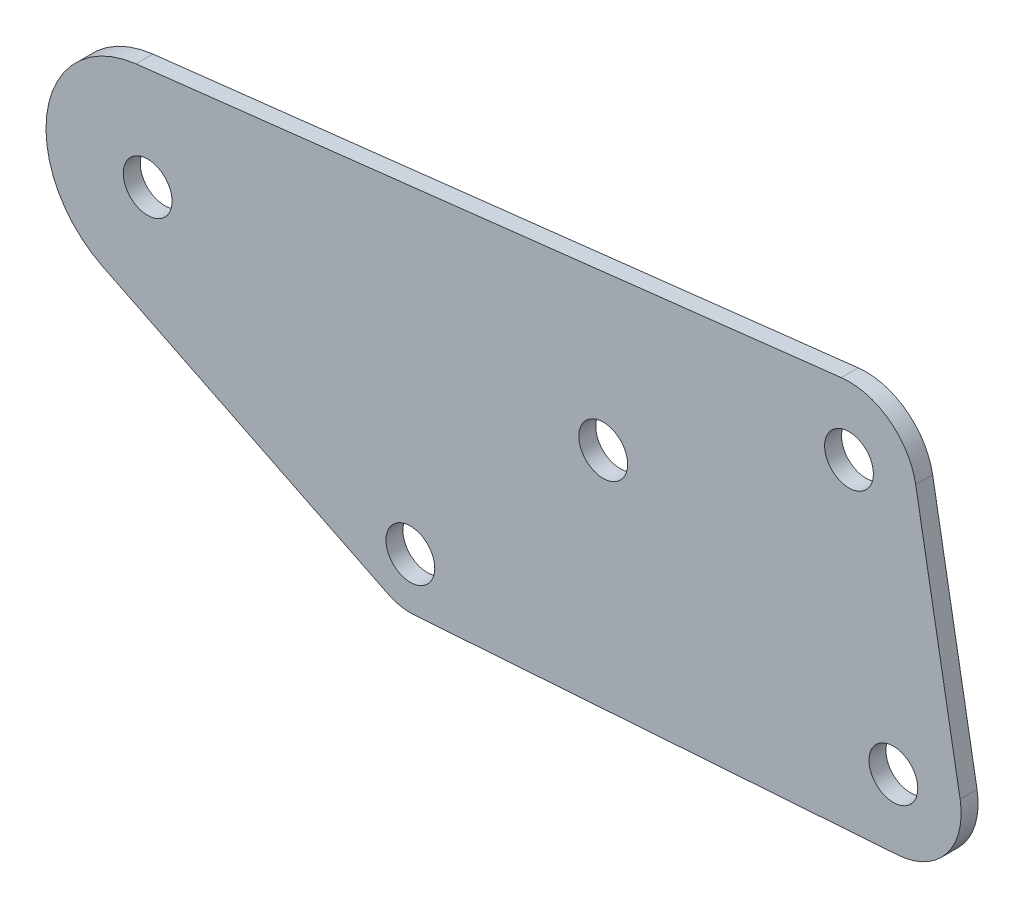
from build123d import *

# Parameters (mm, degrees)
SKETCH1_R           = 2.286
BOSS_EXTRUDE1_DEPTH = 1.5875


with BuildPart() as part:
    # Sketch1 → Boss-Extrude1 (new body)
    with BuildSketch(Plane.XY):
        with BuildLine():
            Line((64.968259902, 17.043099966), (-1.085936833, 9.462894176))
            ThreePointArc((-1.085936833, 9.462894176), (-9.384101761, 1.632255842), (-4.21740813, -8.540438728))
            Line((-4.21740813, -8.540438728), (22.497545935, -21.732719364))
            ThreePointArc((22.497545935, -21.732719364), (23.68644243, -22.135332148), (24.939233683, -22.21334499))
            Line((24.939233683, -22.21334499), (70.293978244, -19.034459986))
            ThreePointArc((70.293978244, -19.034459986), (74.856257907, -16.606389864), (76.102355552, -11.590698397))
            Line((76.102355552, -11.590698397), (71.944573343, 11.843805451))
            ThreePointArc((71.944573343, 11.843805451), (69.486814086, 15.826020219), (64.968259902, 17.043099966))
        make_face()
        Circle(SKETCH1_R, mode=Mode.SUBTRACT)
        with Locations((42.672, 0)):
            Circle(SKETCH1_R, mode=Mode.SUBTRACT)
        with Locations((65.692217791, 10.734503848)):
            Circle(SKETCH1_R, mode=Mode.SUBTRACT)
        with Locations((24.60625, -17.4625)):
            Circle(SKETCH1_R, mode=Mode.SUBTRACT)
        with Locations((69.85, -12.7)):
            Circle(SKETCH1_R, mode=Mode.SUBTRACT)
    extrude(amount=BOSS_EXTRUDE1_DEPTH)


solid = part.part
